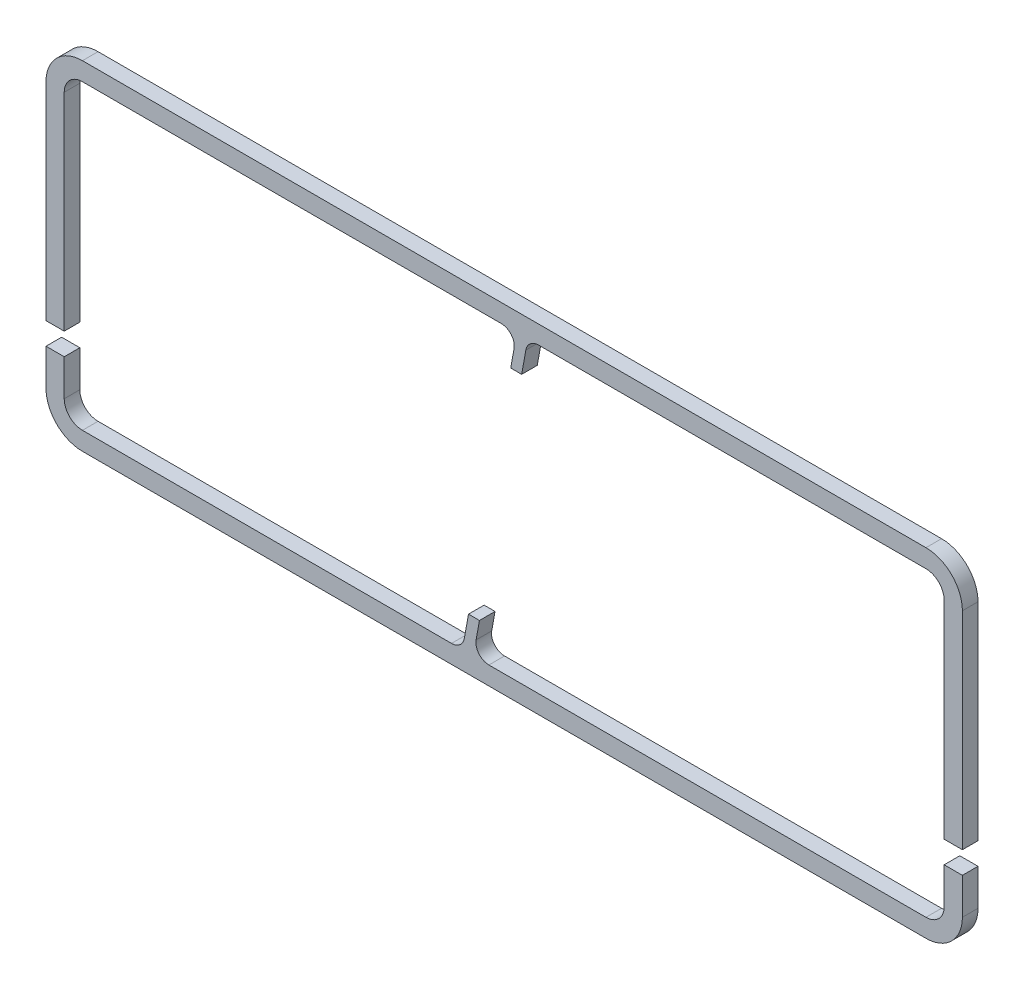
from build123d import *

# Parameters (mm, degrees)
SALIENTE_EXTRUIR3_DEPTH   = 6
SALIENTE_EXTRUIR3_2_DEPTH = 6


with BuildPart() as part:
    # Croquis1 → Saliente-Extruir3 (new body)
    with BuildSketch(Plane.XY):
        with BuildLine():
            Line((-162.0605, 58), (-1.12905479, 58))
            ThreePointArc((-1.12905479, 58), (2.707330681, 56.206578631), (3.791613878, 52.112858607))
            Line((3.791613878, 52.112858607), (2.509245217, 45))
            Line((2.509245217, 45), (6.716745749, 45))
            Line((6.716745749, 45), (8.318997704, 53.887141393))
            ThreePointArc((8.318997704, 53.887141393), (10.033087742, 56.836385471), (13.239666373, 58))
            Line((13.239666373, 58), (162.0605, 58))
            ThreePointArc((162.0605, 58), (167.010247468, 55.949747468), (169.0605, 51))
            Line((169.0605, 51), (169.0605, -28.52))
            Line((169.0605, -28.52), (176.0605, -28.52))
            Line((176.0605, -28.52), (176.0605, 51))
            ThreePointArc((176.0605, 51), (171.959994937, 60.899494937), (162.0605, 65))
            Line((162.0605, 65), (-162.0605, 65))
            ThreePointArc((-162.0605, 65), (-171.959994937, 60.899494937), (-176.0605, 51))
            Line((-176.0605, 51), (-176.0605, -28.52))
            Line((-176.0605, -28.52), (-169.0605, -28.52))
            Line((-169.0605, -28.52), (-169.0605, 51))
            ThreePointArc((-169.0605, 51), (-167.010247468, 55.949747468), (-162.0605, 58))
        make_face()
    extrude(amount=SALIENTE_EXTRUIR3_DEPTH)


with BuildPart() as body_2:
    # Croquis1 → Saliente-Extruir3 2 (new body)
    with BuildSketch(Plane.XY):
        with BuildLine():
            Line((-162.0605, -65), (162.0605, -65))
            ThreePointArc((162.0605, -65), (171.959994937, -60.899494937), (176.0605, -51))
            Line((176.0605, -51), (176.0605, -37.02))
            Line((176.0605, -37.02), (169.0605, -37.02))
            Line((169.0605, -37.02), (169.0605, -51))
            ThreePointArc((169.0605, -51), (167.010247468, -55.949747468), (162.0605, -58))
            Line((162.0605, -58), (-5.87094521, -58))
            ThreePointArc((-5.87094521, -58), (-9.707330681, -56.206578631), (-10.791613878, -52.112858607))
            Line((-10.791613878, -52.112858607), (-9.509245217, -45))
            Line((-9.509245217, -45), (-13.716745749, -45))
            Line((-13.716745749, -45), (-15.318997704, -53.887141393))
            ThreePointArc((-15.318997704, -53.887141393), (-17.033087742, -56.836385471), (-20.239666373, -58))
            Line((-20.239666373, -58), (-162.0605, -58))
            ThreePointArc((-162.0605, -58), (-167.010247468, -55.949747468), (-169.0605, -51))
            Line((-169.0605, -51), (-169.0605, -37.02))
            Line((-169.0605, -37.02), (-176.0605, -37.02))
            Line((-176.0605, -37.02), (-176.0605, -51))
            ThreePointArc((-176.0605, -51), (-171.959994937, -60.899494937), (-162.0605, -65))
        make_face()
    extrude(amount=SALIENTE_EXTRUIR3_2_DEPTH)


solid = Compound([part.part, body_2.part])
